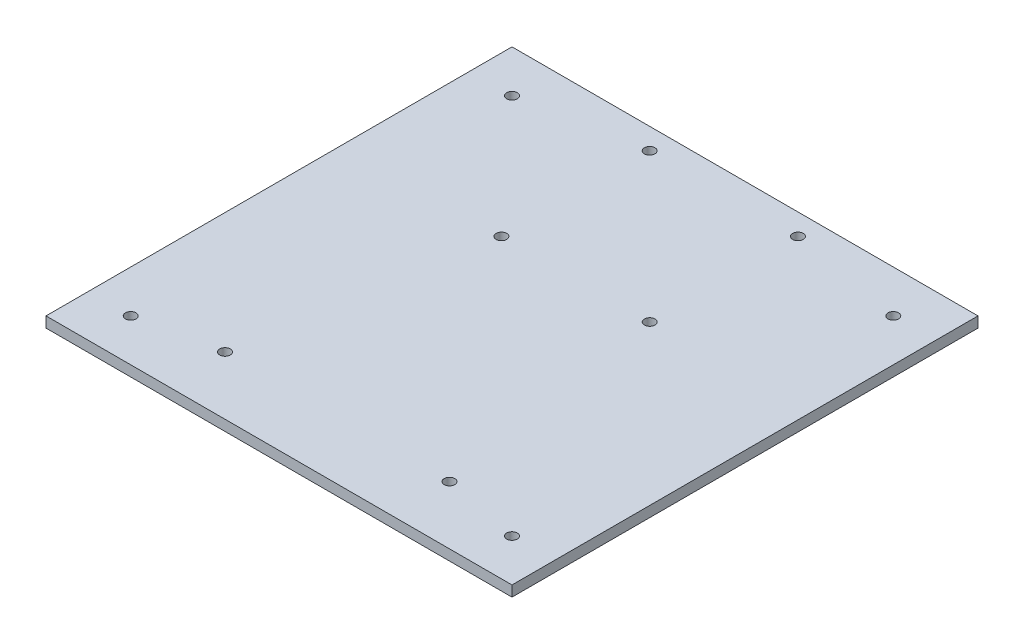
from build123d import *

# Parameters (mm, degrees)
CROQUIS1_W              = 220
CROQUIS1_H              = 220
SALIENTE_EXTRUIR1_DEPTH = 5
CROQUIS2_R              = 2.5
CORTAR_EXTRUIR1_DEPTH   = 156.643824163
CROQUIS3_R              = 2.5
CORTAR_EXTRUIR2_DEPTH   = 10


with BuildPart() as part:
    # Croquis1 → Saliente-Extruir1 (new body)
    with BuildSketch(Plane(origin=(0, 0, 0), x_dir=(1, 0, 0), z_dir=(0, 1, 0))):
        Rectangle(CROQUIS1_W, CROQUIS1_H)
    extrude(amount=SALIENTE_EXTRUIR1_DEPTH)

    # Croquis2 → Cortar-Extruir1 (cut, through all)
    with BuildSketch(Plane(origin=(0, 5, 0), x_dir=(1, 0, 0), z_dir=(0, 1, 0))):
        with Locations(Location((-90, 90, 0), (0, 0, 270))):
            Circle(CROQUIS2_R)
        with Locations(Location((90, 90, 0), (0, 0, 90))):
            Circle(CROQUIS2_R)
        with Locations(Location((90, -90, 0), (0, 0, 270))):
            Circle(CROQUIS2_R)
        with Locations(Location((-90, -90, 0), (0, 0, 90))):
            Circle(CROQUIS2_R)
    extrude(amount=-CORTAR_EXTRUIR1_DEPTH, mode=Mode.SUBTRACT)

    # Croquis3 → Cortar-Extruir2 (cut)
    with BuildSketch(Plane(origin=(0, 5, 0), x_dir=(1, 0, 0), z_dir=(0, 1, 0))):
        with Locations(Location((-35, 100, 0), (0, 0, 270))):
            Circle(CROQUIS3_R)
        with Locations(Location((35, 100, 0), (0, 0, 270))):
            Circle(CROQUIS3_R)
        with Locations(Location((-35, 30, 0), (0, 0, 270))):
            Circle(CROQUIS3_R)
        with Locations(Location((35, 30, 0), (0, 0, 270))):
            Circle(CROQUIS3_R)
        with Locations(Location((-53, -82.5, 0), (0, 0, 270))):
            Circle(CROQUIS3_R)
        with Locations(Location((53, -82.5, 0), (0, 0, 270))):
            Circle(CROQUIS3_R)
    extrude(amount=-CORTAR_EXTRUIR2_DEPTH, mode=Mode.SUBTRACT)


solid = part.part
